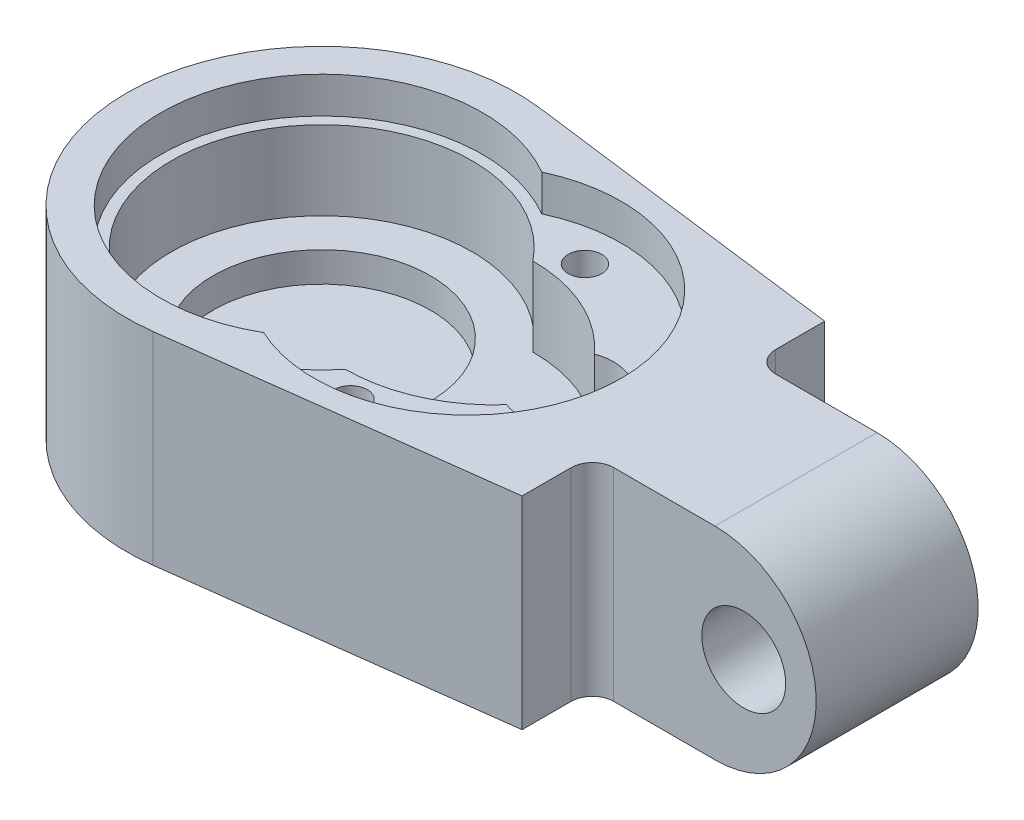
from build123d import *

# Parameters (mm, degrees)
BOSS_EXTRUDE1_DEPTH        = 12.065
FILLET2_R                  = 1.27
FILLET3_R                  = 1.27
CUT_EXTRUDE1_REACH         = 41.898
F_5_0_5_DIAMETER_HOLE1_D   = 5
CUT_EXTRUDE2_DEPTH         = 2.159
CUT_EXTRUDE3_DEPTH         = 4.699
F_97_0_22_DIAMETER_HOLE1_D = 5.588
SKETCH12_R                 = 6.477
CUT_EXTRUDE4_DEPTH         = 1.778
M2X0_4_TAPPED_HOLE1_D      = 2
M2X0_4_TAPPED_HOLE1_DEPTH  = 4.2418
M2X0_4_TAPPED_HOLE1_TIP    = 0.600860619


with BuildPart() as part:
    # Sketch1 → Boss-Extrude1 (new body)
    with BuildSketch(Plane(origin=(0, 0, 0), x_dir=(1, 0, 0), z_dir=(0, 1, 0))):
        with BuildLine():
            Line((20.955, 9.017), (20.955, 4.826))
            Line((20.955, 4.826), (34.29, 4.826))
            Line((34.29, 4.826), (34.29, -4.826))
            Line((34.29, -4.826), (20.955, -4.826))
            Line((20.955, -4.826), (20.955, -9.017))
            Line((20.955, -9.017), (1.484742221, -11.525257515))
            ThreePointArc((1.484742221, -11.525257515), (-11.6205, 0), (1.484742221, 11.525257515))
            Line((1.484742221, 11.525257515), (20.955, 9.017))
        make_face()
    extrude(amount=BOSS_EXTRUDE1_DEPTH)

    # Fillet2
    fillet2_edges = [part.edges().sort_by_distance(p)[0] for p in [
        (20.955, 6.0325, 4.826),
    ]]
    fillet(fillet2_edges, radius=FILLET2_R)

    # Fillet3
    fillet3_edges = [part.edges().sort_by_distance(p)[0] for p in [
        (20.955, 6.0325, -4.826),
    ]]
    fillet(fillet3_edges, radius=FILLET3_R)

    # Sketch3 → Cut-Extrude1 (cut, up to next)
    with BuildSketch(Plane(origin=(0, 0, -4.826), x_dir=(-1, 0, 0), z_dir=(0, 0, -1)), mode=Mode.PRIVATE) as cut_extrude1_sk1:
        with BuildLine():
            ThreePointArc((-34.29, 6.0325), (-32.523121658, 10.298121658), (-28.2575, 12.065))
            Line((-28.2575, 12.065), (-34.29, 12.065))
            Line((-34.29, 12.065), (-34.29, 6.0325))
        make_face()
    cut_extrude1_tool1 = extrude(cut_extrude1_sk1.sketch, amount=-CUT_EXTRUDE1_REACH, mode=Mode.PRIVATE) & part.part
    # Sketch3 → Cut-Extrude1 (cut, up to next)
    with BuildSketch(Plane(origin=(0, 0, -4.826), x_dir=(-1, 0, 0), z_dir=(0, 0, -1)), mode=Mode.PRIVATE) as cut_extrude1_sk2:
        with BuildLine():
            ThreePointArc((-28.2575, 0), (-32.523121658, 1.766878342), (-34.29, 6.0325))
            Line((-34.29, 6.0325), (-34.29, 0))
            Line((-34.29, 0), (-28.2575, 0))
        make_face()
    cut_extrude1_tool2 = extrude(cut_extrude1_sk2.sketch, amount=-CUT_EXTRUDE1_REACH, mode=Mode.PRIVATE) & part.part
    add(cut_extrude1_tool1.solids().sort_by_distance((32.942533, 10.717533, -4.826))[0], mode=Mode.SUBTRACT)
    add(cut_extrude1_tool2.solids().sort_by_distance((32.942533, 1.347467, -4.826))[0], mode=Mode.SUBTRACT)

    # Ø5.0 (5) Diameter Hole1 (through all)
    with Locations(Plane.XY.offset(4.826)):
        with Locations((29.972, 6.0325)):
            Hole(F_5_0_5_DIAMETER_HOLE1_D / 2)

    # Sketch8 → Cut-Extrude2 (cut)
    with BuildSketch(Plane(origin=(0, 12.065, 0), x_dir=(1, 0, 0), z_dir=(0, 1, 0))):
        with BuildLine():
            ThreePointArc((4.828317518, 8.284122295), (-9.5885, 0), (4.828317518, -8.284122295))
            ThreePointArc((4.828317518, -8.284122295), (17.8435, 0), (4.828317518, 8.284122295))
        make_face()
    extrude(amount=-CUT_EXTRUDE2_DEPTH, mode=Mode.SUBTRACT)

    # Sketch9 → Cut-Extrude3 (cut)
    with BuildSketch(Plane(origin=(0, 9.906, 0), x_dir=(1, 0, 0), z_dir=(0, 1, 0))):
        with BuildLine():
            ThreePointArc((6.995671394, 5.588), (-8.9535, 0), (6.995671394, -5.588))
            ThreePointArc((6.995671394, -5.588), (11.975498152, -4.059363478), (15.24, 0))
            ThreePointArc((15.24, 0), (11.975498152, 4.059363478), (6.995671394, 5.588))
        make_face()
    extrude(amount=-CUT_EXTRUDE3_DEPTH, mode=Mode.SUBTRACT)

    # #97 (0.22) Diameter Hole1 (through all)
    with Locations(Plane(origin=(0, 0, 0), x_dir=(-1, 0, 0), z_dir=(0, -1, 0))):
        with Locations((-14.605, 0)):
            Hole(F_97_0_22_DIAMETER_HOLE1_D / 2)

    # Sketch12 → Cut-Extrude4 (cut)
    with BuildSketch(Plane(origin=(0, 5.207, 0), x_dir=(1, 0, 0), z_dir=(0, 1, 0))):
        with Locations(Location((0, 0, 0), (0, 0, 270))):
            Circle(SKETCH12_R)
    extrude(amount=-CUT_EXTRUDE4_DEPTH, mode=Mode.SUBTRACT)

    # M2x0.4 Tapped Hole1
    with Locations(Plane(origin=(0, 9.906, 0), x_dir=(1, 0, 0), z_dir=(0, 1, 0))):
        with Locations((8.6995, 6.985), (8.6995, -6.985)):
            Hole(M2X0_4_TAPPED_HOLE1_D / 2, depth=M2X0_4_TAPPED_HOLE1_DEPTH)
            with Locations((0, 0, -(M2X0_4_TAPPED_HOLE1_DEPTH + M2X0_4_TAPPED_HOLE1_TIP / 2))):  # 118° drill point
                Cone(0, M2X0_4_TAPPED_HOLE1_D / 2, M2X0_4_TAPPED_HOLE1_TIP, mode=Mode.SUBTRACT)


solid = part.part
